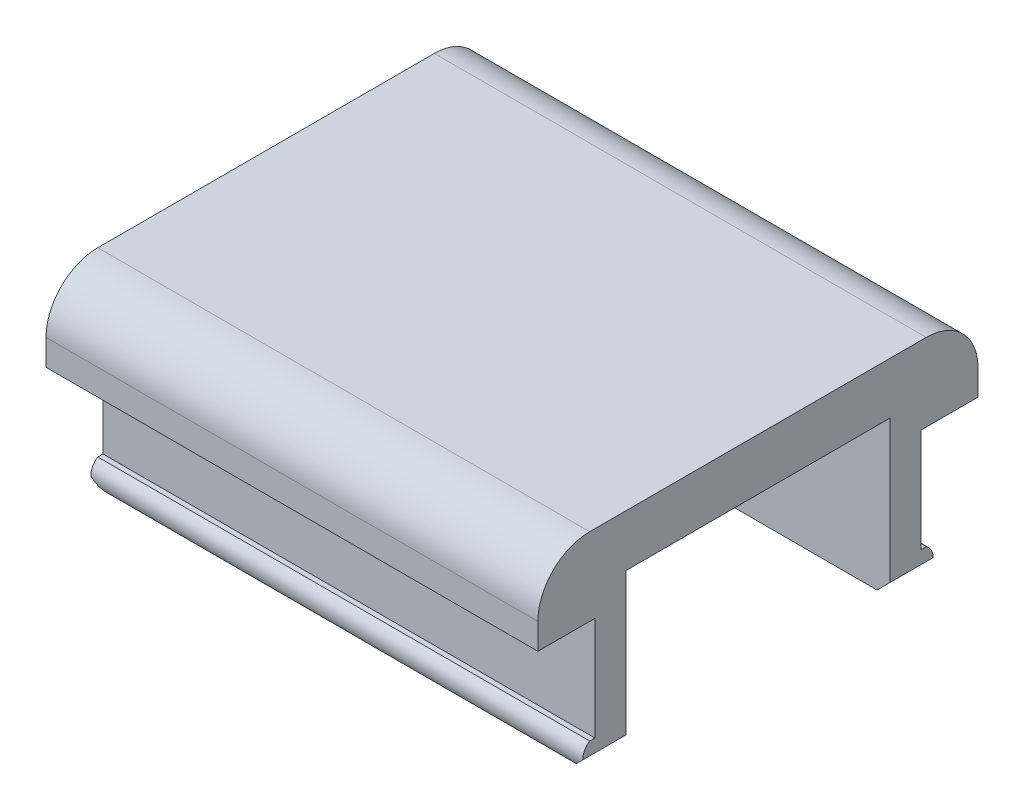
from build123d import *

# Parameters (mm, degrees)
SKETCH1_W           = 17
SKETCH1_H           = 3
BOSS_EXTRUDE1_DEPTH = 19
FILLET1_R           = 2
SKETCH2_W           = 13
SKETCH2_H           = 1
CUT_EXTRUDE1_DEPTH  = 26.670995306
SKETCH3_W           = 19
SKETCH3_H           = 0.6
BOSS_EXTRUDE2_DEPTH = 6
BOSS_EXTRUDE3_DEPTH = 19
SKETCH5_W           = 0.8
SKETCH5_H           = 6
BOSS_EXTRUDE4_DEPTH = 19
SKETCH6_W           = 0.2
SKETCH6_H           = 4
CUT_EXTRUDE11_DEPTH = 19
CHAMFER1_SIZE       = 0.5


with BuildPart() as part:
    # Sketch1 → Boss-Extrude1 (new body)
    with BuildSketch(Plane(origin=(0, 0, 0), x_dir=(0, 0, -1), z_dir=(1, 0, 0))):
        with Locations((8.5, 1.5)):
            Rectangle(SKETCH1_W, SKETCH1_H)
    extrude(amount=BOSS_EXTRUDE1_DEPTH)

    # Fillet1
    fillet1_edges = [part.edges().sort_by_distance(p)[0] for p in [
        (9.5, 3, 0),
        (9.5, 3, -17),
    ]]
    fillet(fillet1_edges, radius=FILLET1_R)

    # Sketch2 → Cut-Extrude1 (cut, through all)
    with BuildSketch(Plane(origin=(19, 0, 0), x_dir=(0, 0, -1), z_dir=(1, 0, 0))):
        with Locations((8.5, 0.5)):
            Rectangle(SKETCH2_W, SKETCH2_H)
    extrude(amount=-CUT_EXTRUDE1_DEPTH, mode=Mode.SUBTRACT)

    # Sketch3 → Boss-Extrude2 (add)
    with BuildSketch(Plane(origin=(0, 1, 0), x_dir=(-1, 0, 0), z_dir=(0, -1, 0))):
        with Locations((-9.5, 2.3)):
            Rectangle(SKETCH3_W, SKETCH3_H)
        with Locations((-9.5, 14.7)):
            Rectangle(SKETCH3_W, SKETCH3_H)
    extrude(amount=BOSS_EXTRUDE2_DEPTH)

    # Sketch4 → Boss-Extrude3 (add)
    with BuildSketch(Plane(origin=(19, 0, 0), x_dir=(0, 0, -1), z_dir=(1, 0, 0))):
        with BuildLine():
            Line((2, -5), (2, -4))
            ThreePointArc((2, -4), (1.731662479, -4.5), (2, -5))
        make_face()
        with BuildLine():
            Line((15, -5), (15, -4))
            ThreePointArc((15, -4), (15.268337521, -4.5), (15, -5))
        make_face()
    extrude(amount=-BOSS_EXTRUDE3_DEPTH)

    # Sketch5 → Boss-Extrude4 (add)
    with BuildSketch(Plane(origin=(19, 0, 0), x_dir=(0, 0, -1), z_dir=(1, 0, 0))):
        with Locations((3, -2)):
            Rectangle(SKETCH5_W, SKETCH5_H)
        with Locations((14, -2)):
            Rectangle(SKETCH5_W, SKETCH5_H)
    extrude(amount=-BOSS_EXTRUDE4_DEPTH)

    # Sketch6 → Cut-Extrude11 (cut)
    with BuildSketch(Plane(origin=(19, 0, 0), x_dir=(0, 0, -1), z_dir=(1, 0, 0))):
        with Locations((2.1, -2)):
            Rectangle(SKETCH6_W, SKETCH6_H)
        with Locations((14.9, -2)):
            Rectangle(SKETCH6_W, SKETCH6_H)
    extrude(amount=-CUT_EXTRUDE11_DEPTH, mode=Mode.SUBTRACT)

    # Chamfer1
    chamfer1_edges = [part.edges().sort_by_distance(p)[0] for p in [
        (19, -5, -2.7),
        (0, -5, -2.7),
        (0, -5, -14.3),
        (19, -5, -14.3),
    ]]
    chamfer(chamfer1_edges, length=CHAMFER1_SIZE)


solid = part.part
